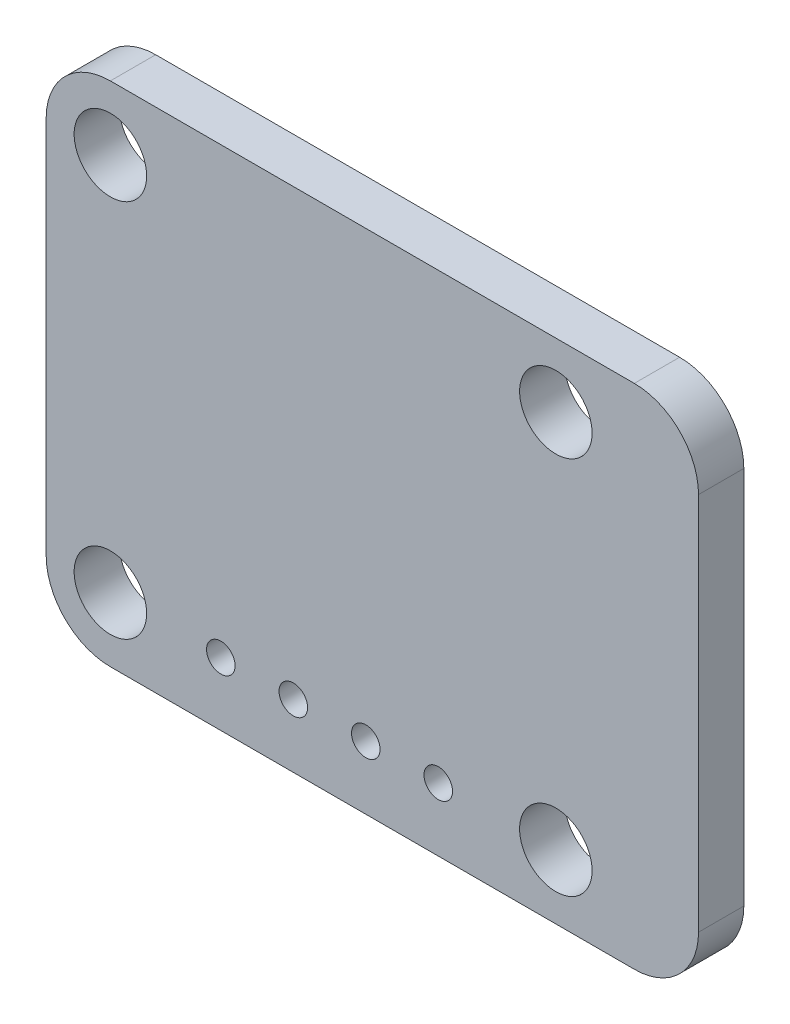
from build123d import *

# Parameters (mm, degrees)
BOSS_EXTRUDE1_DEPTH = 1.5875
SKETCH2_R           = 1.27
SKETCH2_R_2         = 0.5
CUT_EXTRUDE1_DEPTH  = 15.566988579


with BuildPart() as part:
    # Sketch1 → Boss-Extrude1 (new body)
    with BuildSketch(Plane.XY):
        with BuildLine():
            Line((9.18, -8.89), (-9.18, -8.89))
            ThreePointArc((-9.18, -8.89), (-10.770990258, -8.230990258), (-11.43, -6.64))
            Line((-11.43, -6.64), (-11.43, 6.64))
            ThreePointArc((-11.43, 6.64), (-10.770990258, 8.230990258), (-9.18, 8.89))
            Line((-9.18, 8.89), (9.18, 8.89))
            ThreePointArc((9.18, 8.89), (10.770990258, 8.230990258), (11.43, 6.64))
            Line((11.43, 6.64), (11.43, -6.64))
            ThreePointArc((11.43, -6.64), (10.770990258, -8.230990258), (9.18, -8.89))
        make_face()
    extrude(amount=BOSS_EXTRUDE1_DEPTH)

    # Sketch2 → Cut-Extrude1 (cut, through all)
    with BuildSketch(Plane.XY.offset(1.5875)):
        with Locations((-9.18, 6.64)):
            Circle(SKETCH2_R)
        with Locations((6.43, 6.64)):
            Circle(SKETCH2_R)
        with Locations((6.43, -6.64)):
            Circle(SKETCH2_R)
        with Locations((-9.18, -6.64)):
            Circle(SKETCH2_R)
        with Locations((-5.309559509, -6.675167708)):
            Circle(SKETCH2_R_2)
        with Locations((-2.769559509, -6.675167708)):
            Circle(SKETCH2_R_2)
        with Locations((-0.229559509, -6.675167708)):
            Circle(SKETCH2_R_2)
        with Locations((2.310440491, -6.675167708)):
            Circle(SKETCH2_R_2)
    extrude(amount=-CUT_EXTRUDE1_DEPTH, mode=Mode.SUBTRACT)


solid = part.part
